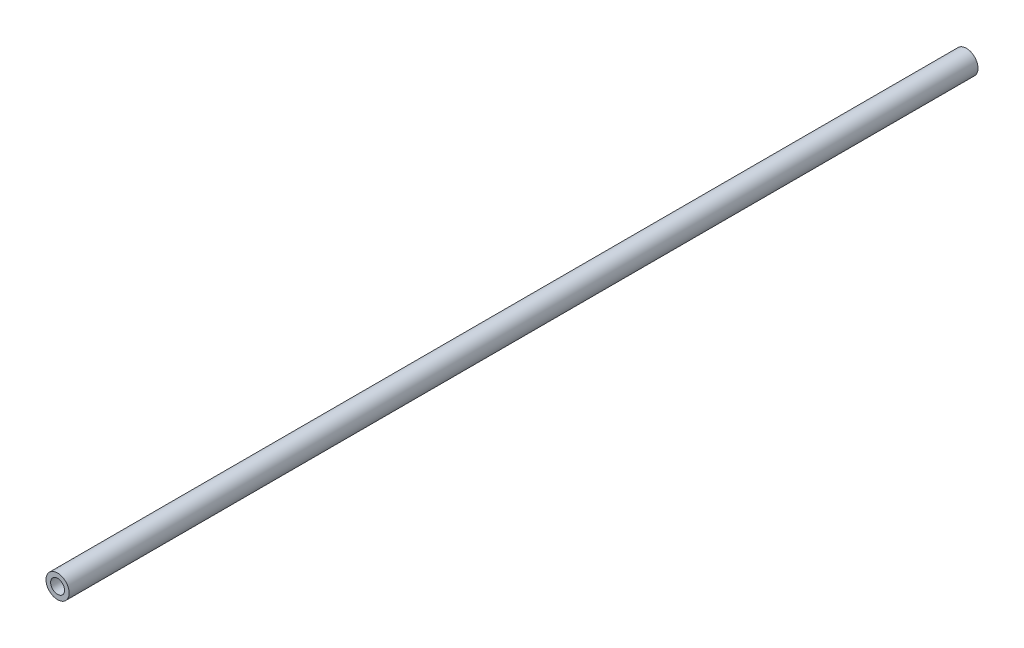
from build123d import *

# Parameters (mm, degrees)
SKETCH1_R          = 0.635
EXTRUDE1_DEPTH     = 49.784
CUT_EXTRUDE1_REACH = 51.792
SKETCH2_R          = 0.381


with BuildPart() as part:
    # Sketch1 → Extrude1 (new body)
    with BuildSketch(Plane.XY):
        Circle(SKETCH1_R)
    extrude(amount=-EXTRUDE1_DEPTH)

    # Sketch2 → Cut-Extrude1 (cut, up to next)
    with BuildSketch(Plane.XY, mode=Mode.PRIVATE) as cut_extrude1_sk1:
        Circle(SKETCH2_R)
    cut_extrude1_tool1 = extrude(cut_extrude1_sk1.sketch, amount=-CUT_EXTRUDE1_REACH, mode=Mode.PRIVATE) & part.part
    add(cut_extrude1_tool1.solids().sort_by_distance((0, 0, 0))[0], mode=Mode.SUBTRACT)


solid = part.part
